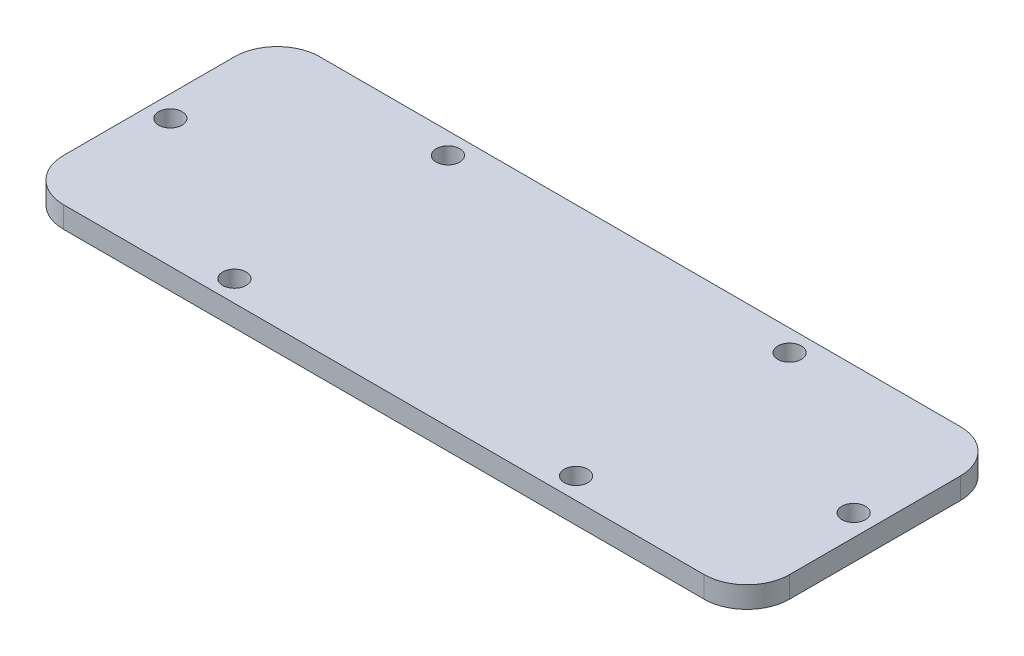
from build123d import *

# Parameters (mm, degrees)
BOSS_EXTRUDE2_DEPTH = 5
SKETCH3_R           = 2.75
CUT_EXTRUDE1_DEPTH  = 5


with BuildPart() as part:
    # Sketch1 → Boss-Extrude2 (new body)
    with BuildSketch(Plane(origin=(0, 0, 0), x_dir=(1, 0, 0), z_dir=(0, 1, 0))):
        with BuildLine():
            Line((10, 0), (160, 0))
            ThreePointArc((160, 0), (167.071067812, 2.928932188), (170, 10))
            Line((170, 10), (170, 50))
            ThreePointArc((170, 50), (167.071067812, 57.071067812), (160, 60))
            Line((160, 60), (10, 60))
            ThreePointArc((10, 60), (2.928932188, 57.071067812), (0, 50))
            Line((0, 50), (0, 10))
            ThreePointArc((0, 10), (2.928932188, 2.928932188), (10, 0))
        make_face()
    extrude(amount=BOSS_EXTRUDE2_DEPTH)

    # Sketch3 → Cut-Extrude1 (cut)
    with BuildSketch(Plane(origin=(0, 5, 0), x_dir=(1, 0, 0), z_dir=(0, 1, 0))):
        with Locations(Location((5, 30, 0), (0, 0, 270))):
            Circle(SKETCH3_R)
        with Locations(Location((45, 55, 0), (0, 0, 270))):
            Circle(SKETCH3_R)
        with Locations(Location((125, 55, 0), (0, 0, 270))):
            Circle(SKETCH3_R)
        with Locations(Location((165, 30, 0), (0, 0, 270))):
            Circle(SKETCH3_R)
        with Locations(Location((125, 5, 0), (0, 0, 270))):
            Circle(SKETCH3_R)
        with Locations(Location((45, 5, 0), (0, 0, 270))):
            Circle(SKETCH3_R)
    extrude(amount=-CUT_EXTRUDE1_DEPTH, mode=Mode.SUBTRACT)


solid = part.part
